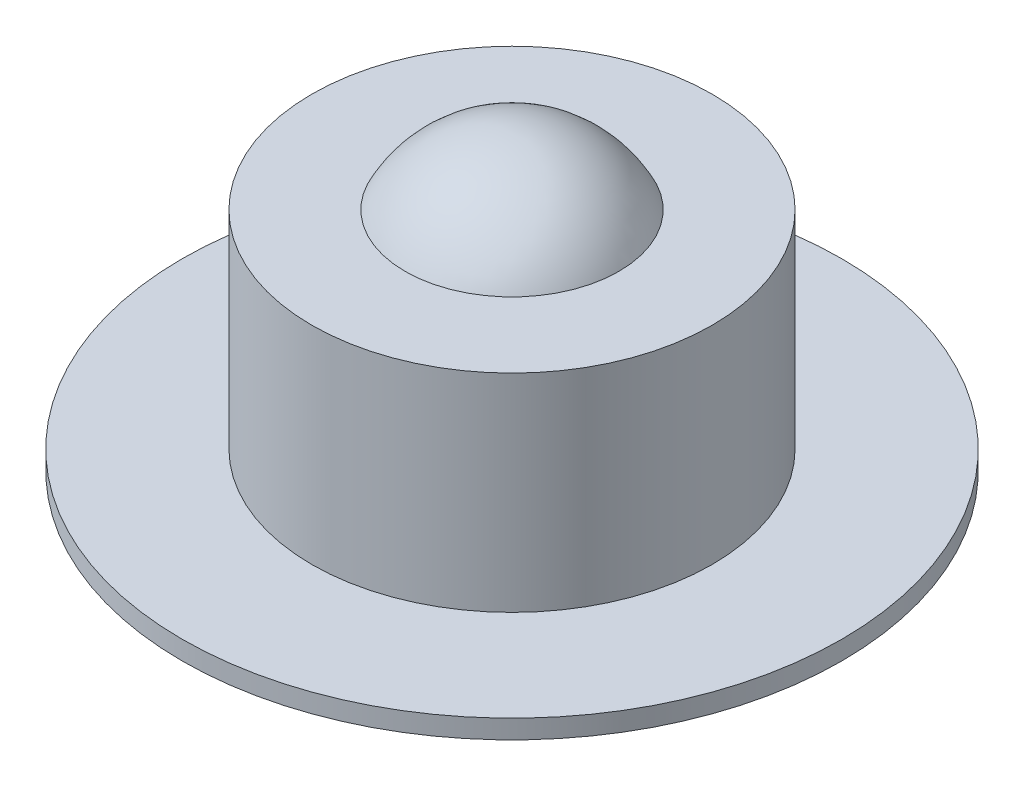
from build123d import *
from build123d.topology import SkipClean

# Parameters (mm, degrees)
SKETCH_1_R      = 35
EXTRUDE_1_DEPTH = 2
SKETCH_1_3_R    = 21.25
EXTRUDE_2_DEPTH = 24


with BuildPart() as part:
    # 草图1 → 凸台-拉伸1 (new body)
    with BuildSketch(Plane(origin=(0, 0, 0), x_dir=(1, 0, 0), z_dir=(0, 1, 0))):
        Circle(SKETCH_1_R)
    extrude(amount=EXTRUDE_1_DEPTH)

    # 草图1<3> → 凸台-拉伸2 (add)
    with BuildSketch(Plane(origin=(0, 0, 0), x_dir=(1, 0, 0), z_dir=(0, 1, 0))):
        Circle(SKETCH_1_3_R)
    extrude(amount=EXTRUDE_2_DEPTH)

    # 草图2 → 旋转1 (revolve)
    with SkipClean():  # the faces are left unmerged after this step: merging them gives an invalid solid
        with BuildSketch(Plane.XY):
            with BuildLine():
                ThreePointArc((12.7, 18.3), (0, 31), (-12.7, 18.3))
                Line((-12.7, 18.3), (12.7, 18.3))
            make_face()
        revolve(axis=Axis((-1000, 18.3, 0), (1, 0, 0)))


solid = part.part
